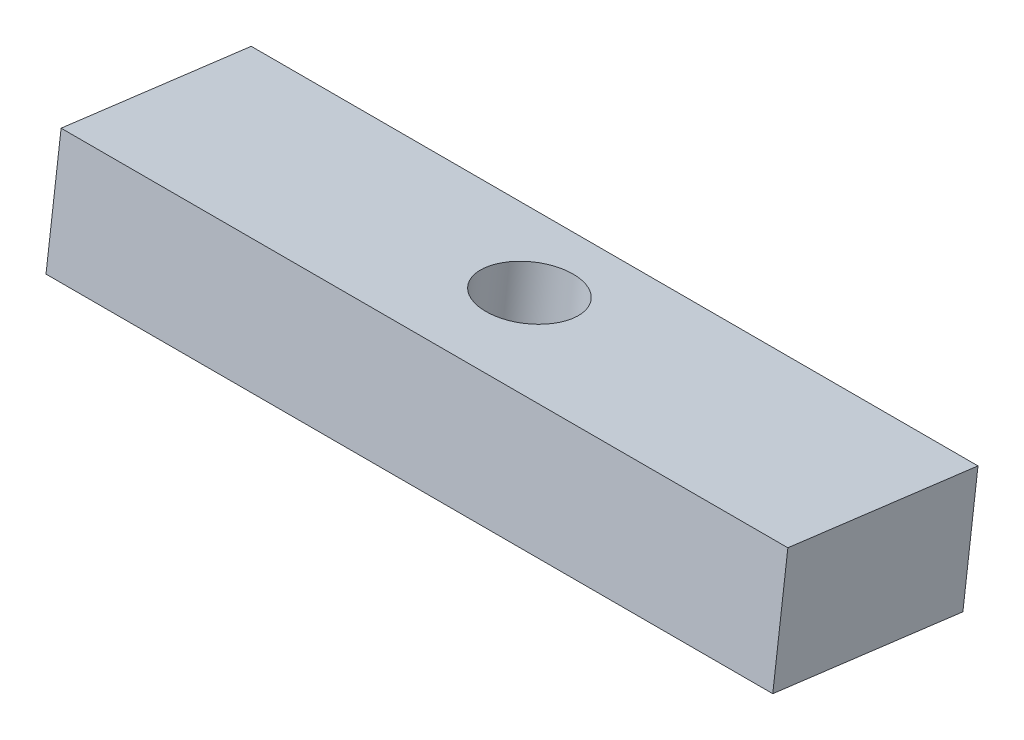
from build123d import *

# Parameters (mm, degrees)
SKETCH1_R           = 1.1
BOSS_EXTRUDE1_DEPTH = 3


with BuildPart() as part:
    # Sketch1 → Boss-Extrude1 (new body)
    with BuildSketch(Plane(origin=(0, 184.723079659, -23.46164399), x_dir=(1, 0, 0), z_dir=(0, -0.9920305444045519, 0.12599761493142836))):
        Polygon((2.55, -106.203400153), (-15.65, -106.203400153), (-15.65, -111.003400153), (-7.1, -111.003400153), (-6, -111.003400153), (2.55, -111.003400153), align=None)
        with Locations(Location((-6.55, -108.853400153, 0), (0, 0, 270))):
            Circle(SKETCH1_R, mode=Mode.SUBTRACT)
    extrude(amount=BOSS_EXTRUDE1_DEPTH)


solid = part.part
